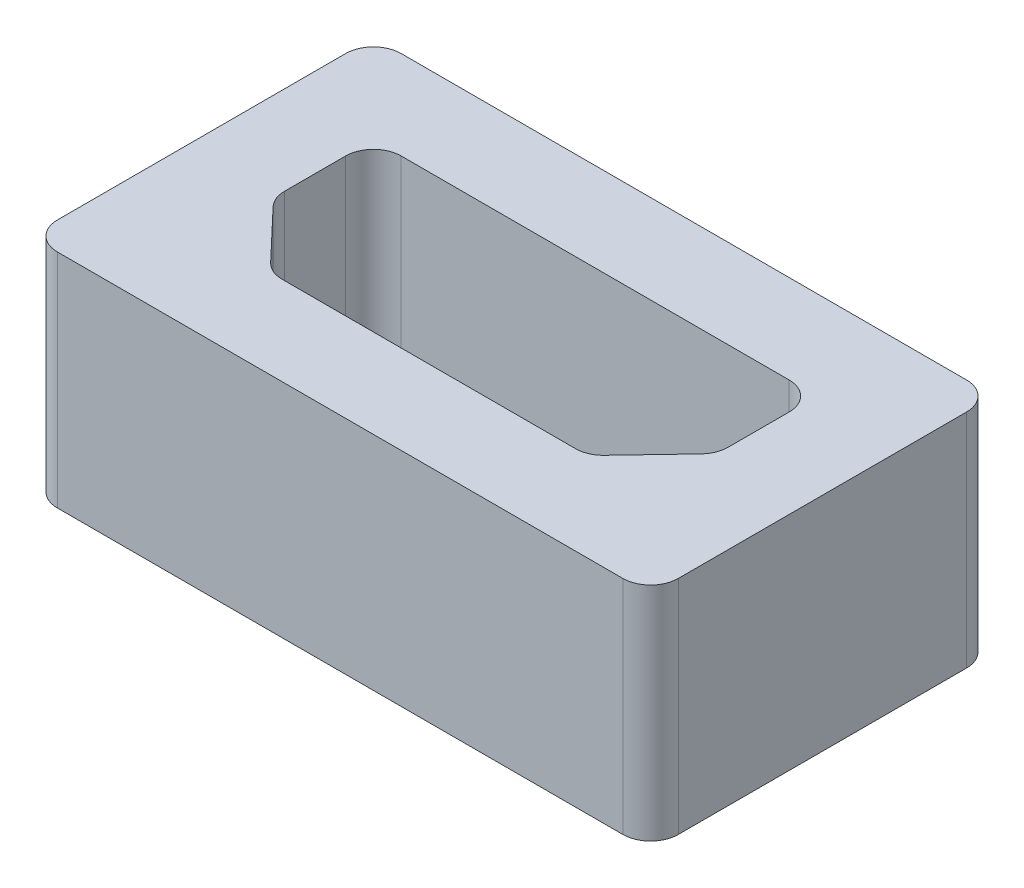
from build123d import *

# Parameters (mm, degrees)
SKETCH_1_W      = 11.2
SKETCH_1_H      = 6.2
SKETCH_1_W_2    = 8
SKETCH_1_H_2    = 3
EXTRUDE_1_DEPTH = 4
FILLET_1_R      = 0.5
FILLET_2_R      = 0.5


with BuildPart() as part:
    # Эскиз1 → Бобышка-Вытянуть1 (new body)
    # profile 1 of 4: a face of its own
    with BuildSketch(Plane(origin=(0, 0, 0), x_dir=(1, 0, 0), z_dir=(0, 1, 0))):
        with Locations((4, 1.5)):
            Rectangle(SKETCH_1_W, SKETCH_1_H)
        with Locations((4, 1.5)):
            Rectangle(SKETCH_1_W_2, SKETCH_1_H_2, mode=Mode.SUBTRACT)
    # profile 2 of 4: a face of its own
    with BuildSketch(Plane(origin=(0, 0, 0), x_dir=(1, 0, 0), z_dir=(0, 1, 0))):
        Polygon((4, 4.6), (-1.6, 4.6), (-1.6, -1.6), (4, -1.6), (4, 0), (1.138545398, 0), (0, 0), (0, 1.197894344), (0, 3), (4, 3), align=None)
    # profile 3 of 4: a face of its own
    with BuildSketch(Plane(origin=(0, 0, 0), x_dir=(1, 0, 0), z_dir=(0, 1, 0))):
        Polygon((1.138545398, 0), (0, 1.197894344), (0, 0), align=None)
    # profile 4 of 4: a face of its own
    with BuildSketch(Plane(origin=(0, 0, 0), x_dir=(1, 0, 0), z_dir=(0, 1, 0))):
        Polygon((8, 0), (8, 1.197894344), (6.861454602, 0), align=None)
    extrude(amount=EXTRUDE_1_DEPTH)

    # Скругление1
    fillet_1_edges = [part.edges().sort_by_distance(p)[0] for p in [
        (8, 2, -3),
        (0, 2, -3),
    ]]
    fillet(fillet_1_edges, radius=FILLET_1_R)

    # Скругление2
    fillet_2_edges = [part.edges().sort_by_distance(p)[0] for p in [
        (9.6, 2, -4.6),
        (9.6, 2, 1.6),
        (-1.6, 2, 1.6),
        (-1.6, 2, -4.6),
        (6.861454602, 2, 0),
        (8, 2, -1.197894344),
        (0, 2, -1.197894344),
        (1.138545398, 2, 0),
    ]]
    fillet(fillet_2_edges, radius=FILLET_2_R)


solid = part.part
